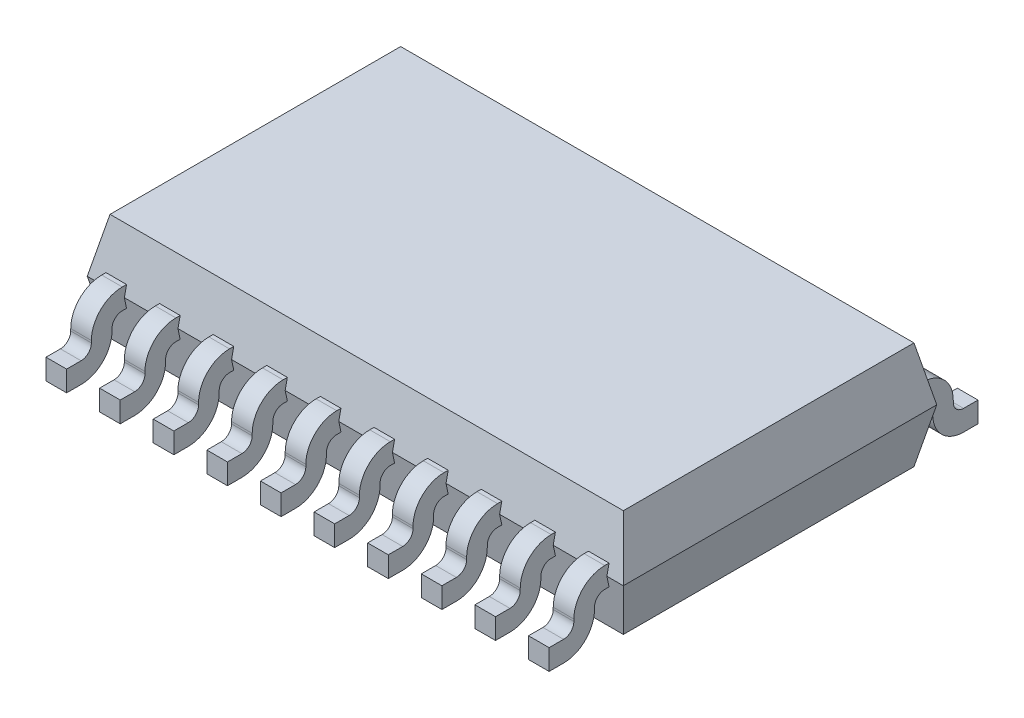
from build123d import *

# Parameters (mm, degrees)
SKETCH1_W                     = 13
SKETCH1_H                     = 7.6
BOSS_EXTRUDE1_DEPTH           = 1.3
BOSS_EXTRUDE1_TAPER           = 12
BOSS_EXTRUDE1_OTHER_WAY_DEPTH = 1.3
BOSS_EXTRUDE1_OTHER_WAY_TAPER = 12
BOSS_EXTRUDE3_DEPTH           = 0.8
BOSS_EXTRUDE3_DEPTH_BACK      = 1
SKETCH2_W                     = 0.5
SKETCH2_H                     = 0.5
SKETCH3_W                     = 0.5
SKETCH3_H                     = 0.5
BOSS_EXTRUDE4_DEPTH           = 1.05
SKETCH4_W                     = 0.5
SKETCH4_H                     = 0.5
BOSS_EXTRUDE5_DEPTH           = 0.6
FILLET1_R                     = 0.25
FILLET2_R                     = 0.75
LPATTERN2_COUNT               = 10
LPATTERN2_PITCH               = 1.3


with BuildPart() as part:
    # Sketch1 → Boss-Extrude1 (new body)
    with BuildSketch(Plane(origin=(0, 0, 0), x_dir=(1, 0, 0), z_dir=(0, 1, 0))):
        Rectangle(SKETCH1_W, SKETCH1_H)
    extrude(amount=BOSS_EXTRUDE1_DEPTH, taper=BOSS_EXTRUDE1_TAPER)

    # Sketch1 → Boss-Extrude1 other way (add)
    with BuildSketch(Plane(origin=(0, 0, 0), x_dir=(1, 0, 0), z_dir=(0, 1, 0))):
        Rectangle(SKETCH1_W, SKETCH1_H)
    extrude(amount=-BOSS_EXTRUDE1_OTHER_WAY_DEPTH, taper=BOSS_EXTRUDE1_OTHER_WAY_TAPER)


with BuildPart() as body_2:
    # Sketch2 → Boss-Extrude3 (new, two sides: drawn at the far end of the back side and taken through both)
    with BuildSketch(Plane.XY.offset(3.8).offset(-BOSS_EXTRUDE3_DEPTH_BACK)):
        with Locations((5.85, 0)):
            Rectangle(SKETCH2_W, SKETCH2_H)
    extrude(amount=BOSS_EXTRUDE3_DEPTH + BOSS_EXTRUDE3_DEPTH_BACK)

    # Sketch3 → Boss-Extrude4 (add)
    with BuildSketch(Plane(origin=(0, -0.25, 0), x_dir=(-1, 0, 0), z_dir=(0, -1, 0))):
        with Locations((-5.85, -4.35)):
            Rectangle(SKETCH3_W, SKETCH3_H)
    extrude(amount=BOSS_EXTRUDE4_DEPTH)

    # Sketch4 → Boss-Extrude5 (add)
    with BuildSketch(Plane.XY.offset(4.6)):
        with Locations((5.85, -1.05)):
            Rectangle(SKETCH4_W, SKETCH4_H)
    extrude(amount=BOSS_EXTRUDE5_DEPTH)

    # Fillet1
    fillet1_edges = [body_2.edges().sort_by_distance(p)[0] for p in [
        (5.85, -0.25, 4.1),
        (5.85, -0.8, 4.6),
    ]]
    fillet(fillet1_edges, radius=FILLET1_R)

    # Fillet2
    fillet2_edges = [body_2.edges().sort_by_distance(p)[0] for p in [
        (5.85, 0.25, 4.6),
        (5.85, -1.3, 4.1),
    ]]
    fillet(fillet2_edges, radius=FILLET2_R)


with BuildPart() as lpattern2_1:
    # LPattern2: pattern copy
    add(body_2.part.moved(Location(Vector(-1, 0, 0) * (1 * LPATTERN2_PITCH))))


with BuildPart() as lpattern2_2:
    # LPattern2: pattern copy
    add(body_2.part.moved(Location(Vector(-1, 0, 0) * (2 * LPATTERN2_PITCH))))


with BuildPart() as lpattern2_3:
    # LPattern2: pattern copy
    add(body_2.part.moved(Location(Vector(-1, 0, 0) * (3 * LPATTERN2_PITCH))))


with BuildPart() as lpattern2_4:
    # LPattern2: pattern copy
    add(body_2.part.moved(Location(Vector(-1, 0, 0) * (4 * LPATTERN2_PITCH))))


with BuildPart() as lpattern2_5:
    # LPattern2: pattern copy
    add(body_2.part.moved(Location(Vector(-1, 0, 0) * (5 * LPATTERN2_PITCH))))


with BuildPart() as lpattern2_6:
    # LPattern2: pattern copy
    add(body_2.part.moved(Location(Vector(-1, 0, 0) * (6 * LPATTERN2_PITCH))))


with BuildPart() as lpattern2_7:
    # LPattern2: pattern copy
    add(body_2.part.moved(Location(Vector(-1, 0, 0) * (7 * LPATTERN2_PITCH))))


with BuildPart() as lpattern2_8:
    # LPattern2: pattern copy
    add(body_2.part.moved(Location(Vector(-1, 0, 0) * (8 * LPATTERN2_PITCH))))


with BuildPart() as lpattern2_9:
    # LPattern2: pattern copy
    add(body_2.part.moved(Location(Vector(-1, 0, 0) * (9 * LPATTERN2_PITCH))))


with BuildPart() as body_12:
    # Mirror2: mirrored copy
    add(lpattern2_7.part.mirror(Plane.XY))


with BuildPart() as body_13:
    # Mirror2 2: mirrored copy
    add(body_2.part.mirror(Plane.XY))


with BuildPart() as body_14:
    # Mirror2 3: mirrored copy
    add(lpattern2_1.part.mirror(Plane.XY))


with BuildPart() as body_15:
    # Mirror2 4: mirrored copy
    add(lpattern2_2.part.mirror(Plane.XY))


with BuildPart() as body_16:
    # Mirror2 5: mirrored copy
    add(lpattern2_3.part.mirror(Plane.XY))


with BuildPart() as body_17:
    # Mirror2 6: mirrored copy
    add(lpattern2_4.part.mirror(Plane.XY))


with BuildPart() as body_18:
    # Mirror2 7: mirrored copy
    add(lpattern2_5.part.mirror(Plane.XY))


with BuildPart() as body_19:
    # Mirror2 8: mirrored copy
    add(lpattern2_6.part.mirror(Plane.XY))


with BuildPart() as body_20:
    # Mirror2 9: mirrored copy
    add(lpattern2_8.part.mirror(Plane.XY))


with BuildPart() as body_21:
    # Mirror2 10: mirrored copy
    add(lpattern2_9.part.mirror(Plane.XY))


solid = Compound([part.part, body_2.part, lpattern2_1.part, lpattern2_2.part, lpattern2_3.part, lpattern2_4.part, lpattern2_5.part, lpattern2_6.part, lpattern2_7.part, lpattern2_8.part, lpattern2_9.part, body_12.part, body_13.part, body_14.part, body_15.part, body_16.part, body_17.part, body_18.part, body_19.part, body_20.part, body_21.part])
